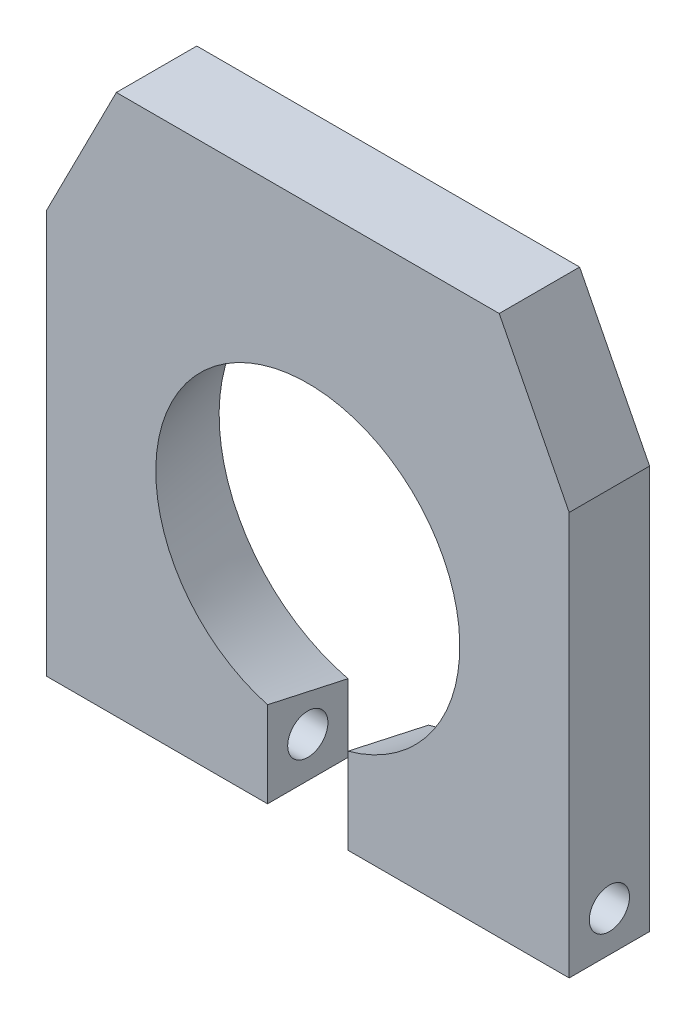
from build123d import *

# Parameters (mm, degrees)
BOSS_EXTRU_1_DEPTH      = 12.7
ESQUISSE2_R             = 3.175
ENL_V_MAT_EXTRU_1_DEPTH = 120.412691269
ENL_V_MAT_EXTRU_2_DEPTH = 120.412691269


with BuildPart() as part:
    # Esquisse1 → Boss.-Extru.1 (new body)
    with BuildSketch(Plane.XY):
        with BuildLine():
            Line((34.925, -85.344), (34.925, -71.788707818))
            ThreePointArc((34.925, -71.788707818), (41.275, -24.644), (47.625, -71.788707818))
            Line((47.625, -71.788707818), (47.625, -85.344))
            Line((47.625, -85.344), (82.55, -85.344))
            Line((82.55, -85.344), (82.55, 0))
            Line((82.55, 0), (0, 0))
            Line((0, 0), (0, -85.344))
            Line((0, -85.344), (34.925, -85.344))
        make_face()
    extrude(amount=BOSS_EXTRU_1_DEPTH)

    # Esquisse2 → Enlèv. mat.-Extru.1 (cut, through all)
    with BuildSketch(Plane(origin=(82.55, 0, 0), x_dir=(0, 0, -1), z_dir=(1, 0, 0))):
        with Locations(Location((-6.35, -78.994, 0), (0, 0, 90))):
            Circle(ESQUISSE2_R)
    extrude(amount=-ENL_V_MAT_EXTRU_1_DEPTH, mode=Mode.SUBTRACT)

    # Esquisse4 → Enlèvement de matière-Révolution1 (revolve, cut)
    with BuildSketch(Plane.XZ.offset(48.644)):
        Polygon((17.275, 12.7), (14.533802376, -0.19632088), (34.925, -0.19632088), (34.925, 12.7), align=None)
    revolve(axis=Axis((41.275, -48.644, 0), (0, 0, 1)), mode=Mode.SUBTRACT)

    # Esquisse5 → Enlèv. mat.-Extru.2 (cut, through all)
    with BuildSketch(Plane(origin=(0, 0, 0), x_dir=(-1, 0, 0), z_dir=(0, 0, -1))):
        Polygon((-71.501, 0), (-82.55, -21.684883475), (-82.55, 0), align=None)
        Polygon((-11.049, 0), (0, -21.684883475), (0, 0), align=None)
    extrude(amount=-ENL_V_MAT_EXTRU_2_DEPTH, mode=Mode.SUBTRACT)


solid = part.part
